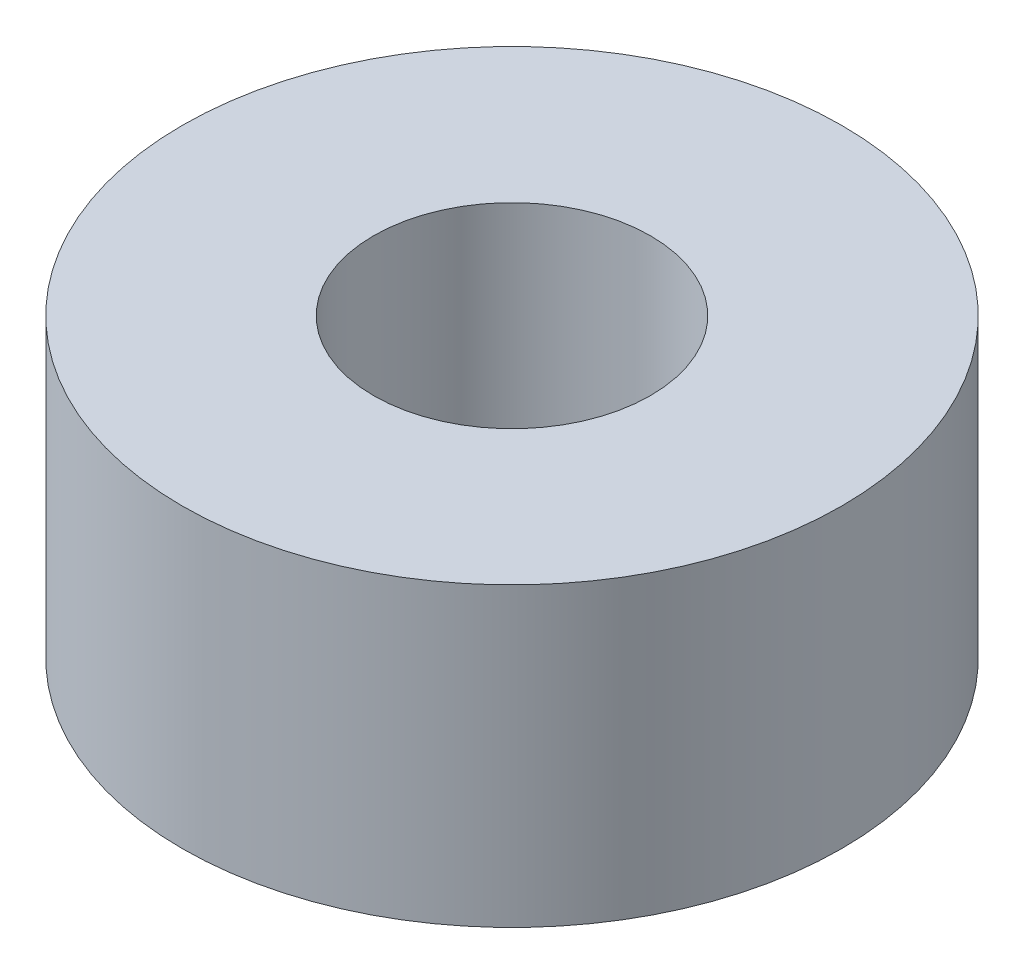
from build123d import *

# Parameters (mm, degrees)
SKETCH1_R           = 5
SKETCH1_R_2         = 2.1
BOSS_EXTRUDE1_DEPTH = 4.5


with BuildPart() as part:
    # Sketch1 → Boss-Extrude1 (new body)
    with BuildSketch(Plane(origin=(0, 0, 0), x_dir=(1, 0, 0), z_dir=(0, 1, 0))):
        with Locations(Location((0, 0, 0), (0, 0, 270))):
            Circle(SKETCH1_R)
        with Locations(Location((0, 0, 0), (0, 0, 270))):
            Circle(SKETCH1_R_2, mode=Mode.SUBTRACT)
    extrude(amount=BOSS_EXTRUDE1_DEPTH)


solid = part.part
